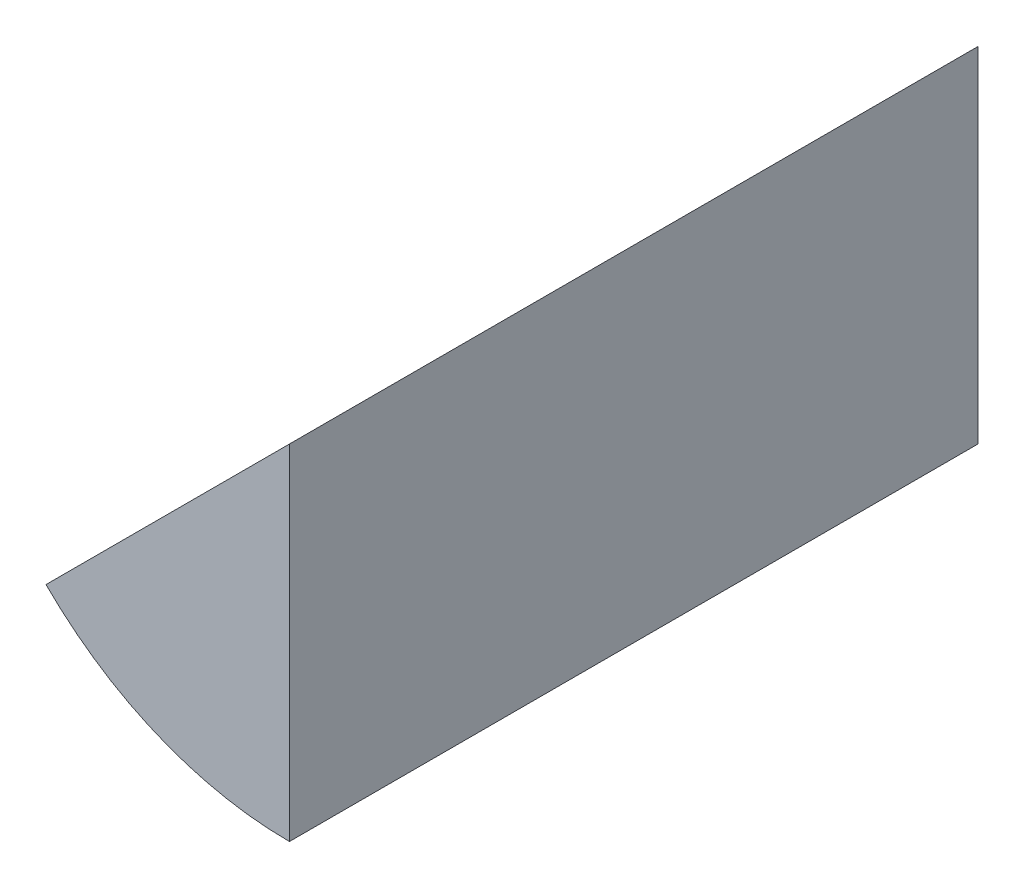
from build123d import *

# Parameters (mm, degrees)
SALIENTE_EXTRUIR1_DEPTH = 50
CROQUIS2_R              = 5
CORTAR_EXTRUIR1_DEPTH   = 10


with BuildPart() as part:
    # Croquis1 → Saliente-Extruir1 (new body)
    with BuildSketch(Plane.XY):
        with BuildLine():
            Line((0, 0), (0, -25))
            ThreePointArc((0, -25), (-9.567085809, -23.096988313), (-17.67766953, -17.67766953))
            Line((-17.67766953, -17.67766953), (0, 0))
        make_face()
    extrude(amount=SALIENTE_EXTRUIR1_DEPTH)

    # Croquis2 → Cortar-Extruir1 (cut)
    with BuildSketch(Plane(origin=(0, 0, 0), x_dir=(-1, 0, 0), z_dir=(0, 0, -1))):
        with Locations((6.697208452, -16.437204442)):
            Circle(CROQUIS2_R)
    extrude(amount=-CORTAR_EXTRUIR1_DEPTH, mode=Mode.SUBTRACT)


solid = part.part
